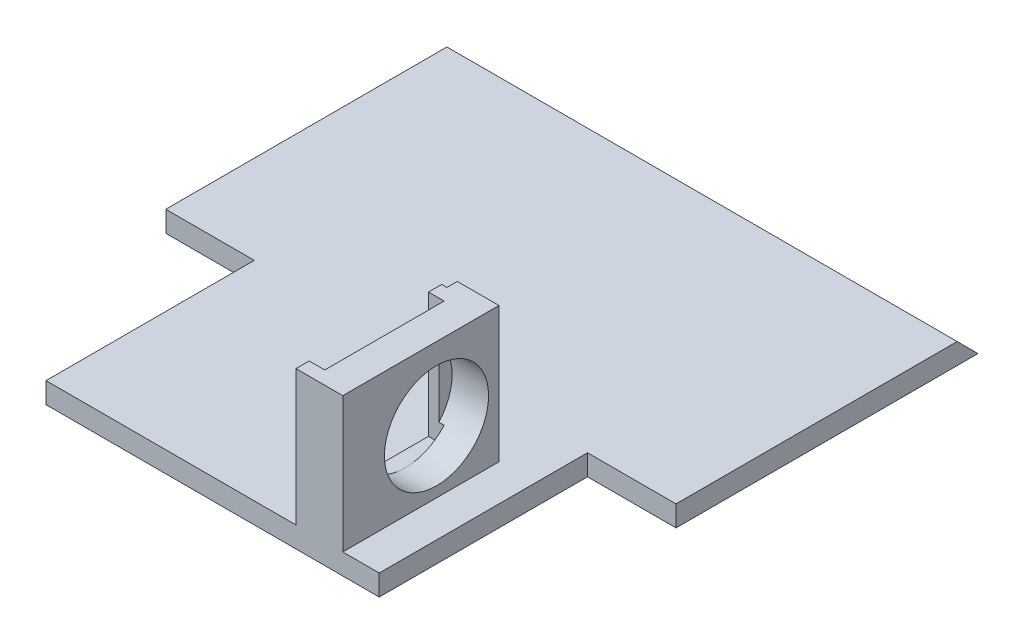
from build123d import *

# Parameters (mm, degrees)
EXTRUDE_1_DEPTH     = 2
EXTRUDE_START       = -2
SKETCH_2_W          = 14
SKETCH_2_H          = 13
SKETCH_2_R          = 1.5
EXTRUDE_2_DEPTH     = 4.5
SKETCH_3_W          = 1.5
SKETCH_3_H          = 1.268219588
EXTRUDE_3_DEPTH     = 13
SKETCH_4_W          = 1.5
SKETCH_4_H          = 1
EXTRUDE_4_DEPTH     = 11.463560824
CUT_EXTRUDE_1_REACH = 39.756
SKETCH_5_W          = 1.5
SKETCH_5_H          = 14
SKETCH_7_W          = 4
SKETCH_7_H          = 1
EXTRUDE_5_DEPTH     = 13
CUT_EXTRUDE_START   = 0.5
SKETCH_6_R          = 5
CUT_EXTRUDE_2_DEPTH = 4
CUT_EXTRUDE_3_DEPTH = 49


with BuildPart() as part:
    # Эскиз1 → Бобышка-Вытянуть1 (new body)
    with BuildSketch(Plane(origin=(0, 0, 0), x_dir=(1, 0, 0), z_dir=(0, 1, 0))):
        Polygon((16, -4.5), (16, -24.5), (-16, -24.5), (-16, -4.5), (-24.5, -4.5), (-24.5, 24.5), (24.5, 24.5), (24.5, -4.5), align=None)
    extrude(amount=EXTRUDE_1_DEPTH)

    # Эскиз2 → Бобышка-Вытянуть2 (add)
    with BuildSketch(Plane(origin=(16, 0, 0), x_dir=(0, 0, -1), z_dir=(1, 0, 0)).offset(EXTRUDE_START)):
        with Locations((-17.5, 8.5)):
            Rectangle(SKETCH_2_W, SKETCH_2_H)
        with Locations((-15.5, 8)):
            Circle(SKETCH_2_R, mode=Mode.SUBTRACT)
    extrude(amount=-EXTRUDE_2_DEPTH)

    # Эскиз3 → Бобышка-Вытянуть3 (add)
    with BuildSketch(Plane(origin=(0, 15, 0), x_dir=(1, 0, 0), z_dir=(0, 1, 0))):
        with Locations((8.75, -11.134109794)):
            Rectangle(SKETCH_3_W, SKETCH_3_H)
        with Locations((8.75, -23.865890206)):
            Rectangle(SKETCH_3_W, SKETCH_3_H)
    extrude(amount=-EXTRUDE_3_DEPTH)

    # Эскиз4 → Бобышка-Вытянуть4 (add)
    with BuildSketch(Plane.XY.offset(11.768219588)):
        with Locations((8.75, 2.5)):
            Rectangle(SKETCH_4_W, SKETCH_4_H)
    extrude(amount=EXTRUDE_4_DEPTH)

    # Вырез-Вытянуть1: up to this face of the body (flat: up to its plane)
    cut_extrude_1_end = Plane(part.part.faces().sort_by_distance((-0.46737481, 2, -3.237228123))[0])
    # Эскиз5 → Вырез-Вытянуть1 (cut, up to the picked face)
    with BuildSketch(Plane(origin=(0, 15, 0), x_dir=(1, 0, 0), z_dir=(0, 1, 0)), mode=Mode.PRIVATE) as cut_extrude_1_sk1:
        with Locations((13.25, -17.5)):
            Rectangle(SKETCH_5_W, SKETCH_5_H)
    cut_extrude_1_tool1 = split(extrude(cut_extrude_1_sk1.sketch, amount=-CUT_EXTRUDE_1_REACH, mode=Mode.PRIVATE), bisect_by=cut_extrude_1_end, keep=Keep.BOTH, mode=Mode.PRIVATE)
    add(cut_extrude_1_tool1.solids().sort_by(Axis((13.25, 15, 17.5), (0, -1, 0)))[0], mode=Mode.SUBTRACT)

    # Эскиз7 → Бобышка-Вытянуть5 (add)
    with BuildSketch(Plane(origin=(0, 15, 0), x_dir=(1, 0, 0), z_dir=(0, 1, 0))):
        with Locations((10.5, -10)):
            Rectangle(SKETCH_7_W, SKETCH_7_H)
    extrude(amount=-EXTRUDE_5_DEPTH)

    # Эскиз6 → Вырез-Вытянуть2 (cut)
    with BuildSketch(Plane(origin=(12.5, 0, 0), x_dir=(0, 0, -1), z_dir=(1, 0, 0)).offset(CUT_EXTRUDE_START)):
        with Locations(Location((-15.5, 8, 0), (0, 0, 270))):
            Circle(SKETCH_6_R)
    extrude(amount=-CUT_EXTRUDE_2_DEPTH, mode=Mode.SUBTRACT)

    # Эскиз8 → Вырез-Вытянуть3 (cut)
    with BuildSketch(Plane(origin=(24.5, 0, 0), x_dir=(0, 0, -1), z_dir=(1, 0, 0))):
        Polygon((24.5, 0), (22.5, 2), (24.5, 2), align=None)
    extrude(amount=-CUT_EXTRUDE_3_DEPTH, mode=Mode.SUBTRACT)


solid = part.part
